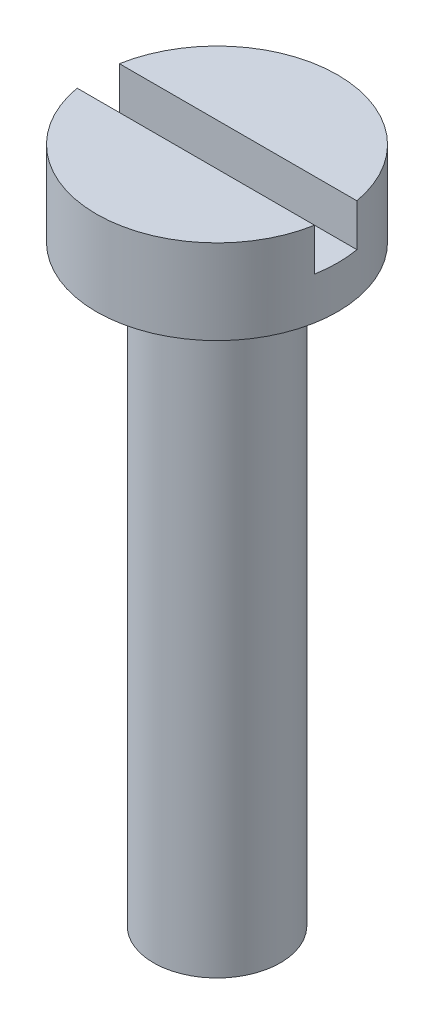
from build123d import *

# Parameters (mm, degrees)
SKETCH1_R           = 2.85
BOSS_EXTRUDE1_DEPTH = 2
SKETCH2_R           = 1.5
BOSS_EXTRUDE2_DEPTH = 14
SKETCH3_W           = 6
SKETCH3_H           = 1
CUT_EXTRUDE1_DEPTH  = 1


with BuildPart() as part:
    # Sketch1 → Boss-Extrude1 (new body)
    with BuildSketch(Plane(origin=(0, 0, 0), x_dir=(1, 0, 0), z_dir=(0, 1, 0))):
        with Locations(Location((0, 0, 0), (0, 0, 270))):
            Circle(SKETCH1_R)
    extrude(amount=BOSS_EXTRUDE1_DEPTH)

    # Sketch2 → Boss-Extrude2 (add)
    with BuildSketch(Plane(origin=(0, 0, 0), x_dir=(1, 0, 0), z_dir=(0, 1, 0))):
        with Locations(Location((0, 0, 0), (0, 0, 270))):
            Circle(SKETCH2_R)
    extrude(amount=-BOSS_EXTRUDE2_DEPTH)

    # Sketch3 → Cut-Extrude1 (cut)
    with BuildSketch(Plane(origin=(0, 2, 0), x_dir=(1, 0, 0), z_dir=(0, 1, 0))):
        Rectangle(SKETCH3_W, SKETCH3_H)
    extrude(amount=-CUT_EXTRUDE1_DEPTH, mode=Mode.SUBTRACT)


solid = part.part
